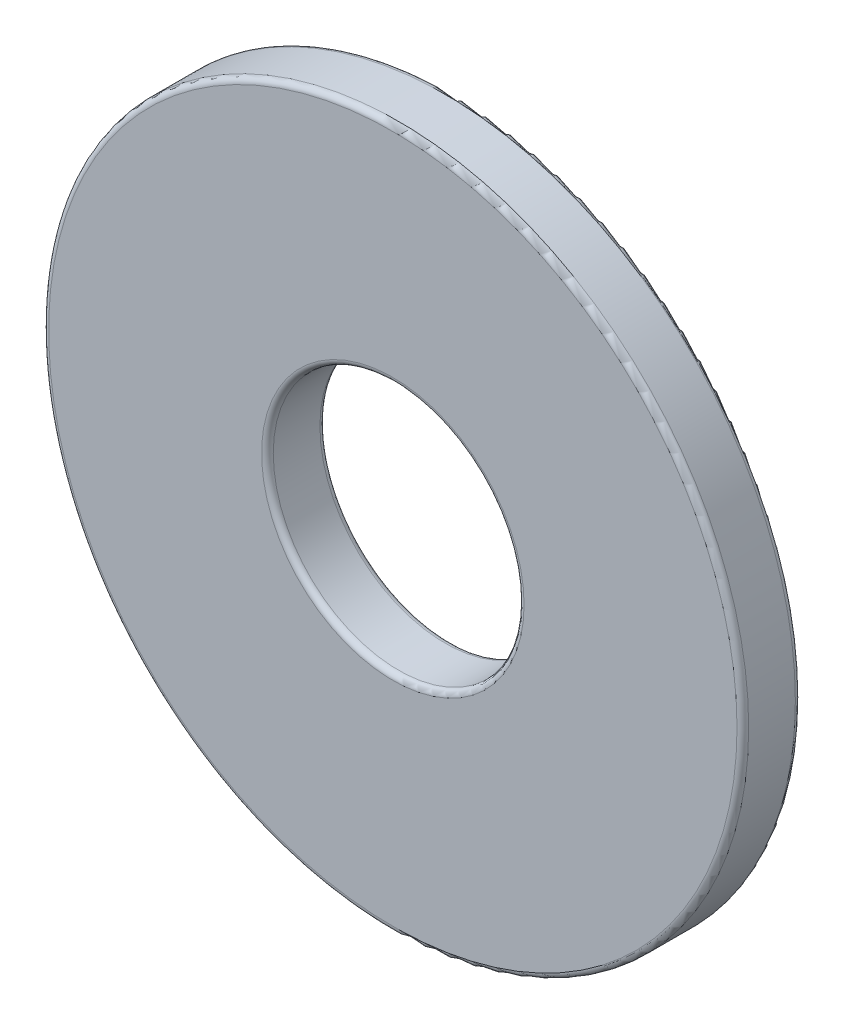
from build123d import *


with BuildPart() as part:
    # 草图1 → 旋转1 (revolve)
    with BuildSketch(Plane(origin=(0, 0, 0), x_dir=(1, 0, 0), z_dir=(0, 1, 0))):
        with BuildLine():
            Line((5.9, 0), (2.25, 0))
            ThreePointArc((2.25, 0), (2.179289322, -0.029289322), (2.15, -0.1))
            Line((2.15, -0.1), (2.15, -0.9))
            ThreePointArc((2.15, -0.9), (2.179289322, -0.970710678), (2.25, -1))
            Line((2.25, -1), (5.9, -1))
            ThreePointArc((5.9, -1), (5.970710678, -0.970710678), (6, -0.9))
            Line((6, -0.9), (6, -0.1))
            ThreePointArc((6, -0.1), (5.970710678, -0.029289322), (5.9, 0))
        make_face()
    revolve(axis=Axis((0, 0, -0.002476268), (0, 0, 1)))


solid = part.part
